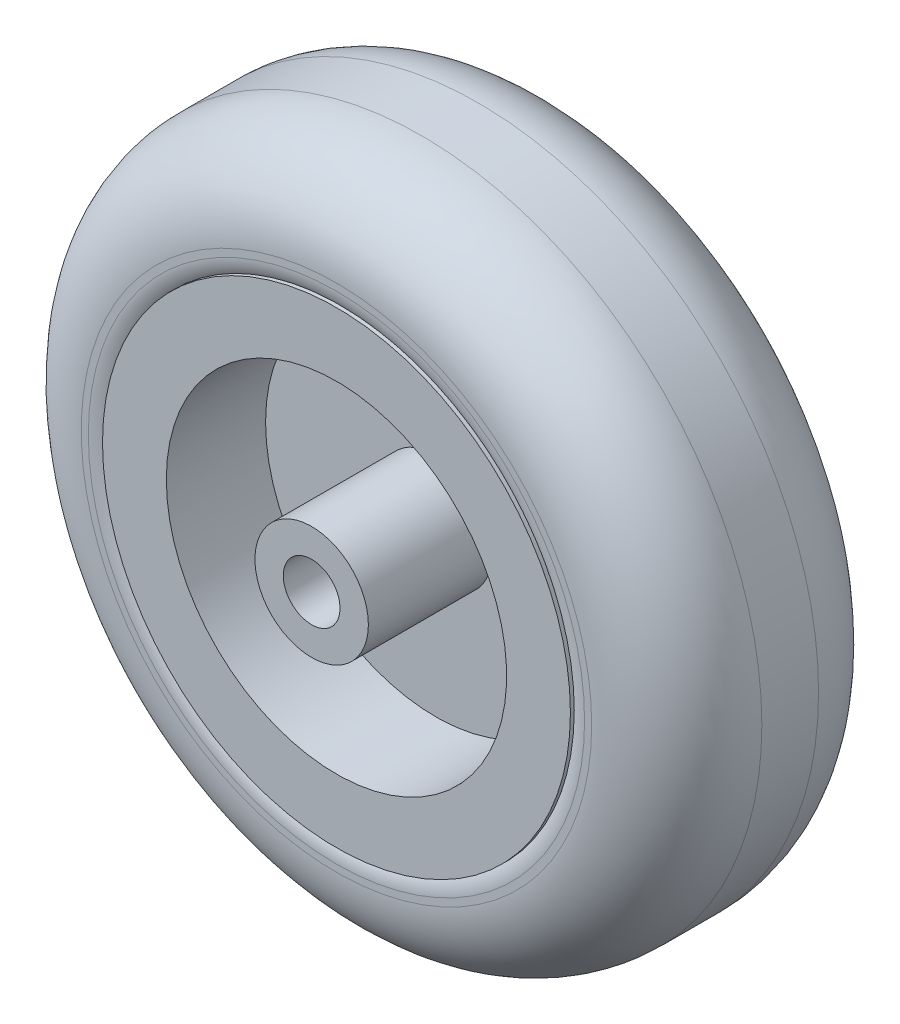
from build123d import *

# Parameters (mm, degrees)
SKETCH1_R           = 76.2
SKETCH1_R_2         = 49.2125
BOSS_EXTRUDE1_DEPTH = 25.4
FILLET1_R           = 19.05
FILLET2_R           = 6.35
SKETCH2_R           = 52.3875
BOSS_EXTRUDE2_DEPTH = 25.4
SKETCH3_W           = 44.45
SKETCH3_H           = 7.9375
SKETCH4_R           = 38.1
SKETCH4_R_2         = 12.7
CUT_EXTRUDE1_DEPTH  = 22.225
SKETCH5_R           = 12.7
BOSS_EXTRUDE3_DEPTH = 30.95625
SKETCH6_R           = 6.35
CUT_EXTRUDE2_DEPTH  = 125.28208904


with BuildPart() as part:
    # Sketch1 → Boss-Extrude1 (new, symmetric)
    with BuildSketch(Plane.XY):
        Circle(SKETCH1_R)
        Circle(SKETCH1_R_2, mode=Mode.SUBTRACT)
    extrude(amount=BOSS_EXTRUDE1_DEPTH, both=True)

    # Fillet1
    fillet1_edges = [part.edges().sort_by_distance(p)[0] for p in [
        (-76.2, 0, -25.4),
        (-76.2, 0, 25.4),
    ]]
    fillet(fillet1_edges, radius=FILLET1_R)

    # Fillet2
    fillet2_edges = [part.edges().sort_by_distance(p)[0] for p in [
        (-49.2125, 0, -25.4),
        (-49.2125, 0, 25.4),
    ]]
    fillet(fillet2_edges, radius=FILLET2_R)


with BuildPart() as body_2:
    # Sketch2 → Boss-Extrude2 (new, symmetric)
    with BuildSketch(Plane.XY):
        Circle(SKETCH2_R)
    extrude(amount=BOSS_EXTRUDE2_DEPTH, both=True)

    # Sketch3 → Cut-Revolve1 (revolve, cut)
    with BuildSketch(Plane(origin=(0, 0, 0), x_dir=(0, 0, -1), z_dir=(1, 0, 0)), mode=Mode.PRIVATE) as cut_revolve1_sk:
        with Locations((0, 48.41875)):
            Rectangle(SKETCH3_W, SKETCH3_H)
    revolve(cut_revolve1_sk.sketch.rotate(Axis((0, 0, 0), (0, 0, -1)), 90), axis=Axis((0, 0, 0), (0, 0, -1)), mode=Mode.SUBTRACT)

    # Sketch4 → Cut-Extrude1 (cut)
    with BuildSketch(Plane(origin=(0, 0, -25.4), x_dir=(-1, 0, 0), z_dir=(0, 0, -1))):
        Circle(SKETCH4_R)
        Circle(SKETCH4_R_2, mode=Mode.SUBTRACT)
    cut_extrude1 = extrude(amount=-CUT_EXTRUDE1_DEPTH, mode=Mode.SUBTRACT)

    # Mirror1: Cut-Extrude1 across plane
    add(cut_extrude1.mirror(Plane.XY), mode=Mode.SUBTRACT)

    # Sketch5 → Boss-Extrude3 (add, symmetric)
    with BuildSketch(Plane.XY):
        with Locations(Location((0, 0, 0), (0, 0, 180))):
            Circle(SKETCH5_R)
    extrude(amount=BOSS_EXTRUDE3_DEPTH, both=True)

    # Sketch6 → Cut-Extrude2 (cut, through all)
    with BuildSketch(Plane(origin=(0, 0, -30.95625), x_dir=(-1, 0, 0), z_dir=(0, 0, -1))):
        Circle(SKETCH6_R)
    extrude(amount=-CUT_EXTRUDE2_DEPTH, mode=Mode.SUBTRACT)


solid = Compound([part.part, body_2.part])
